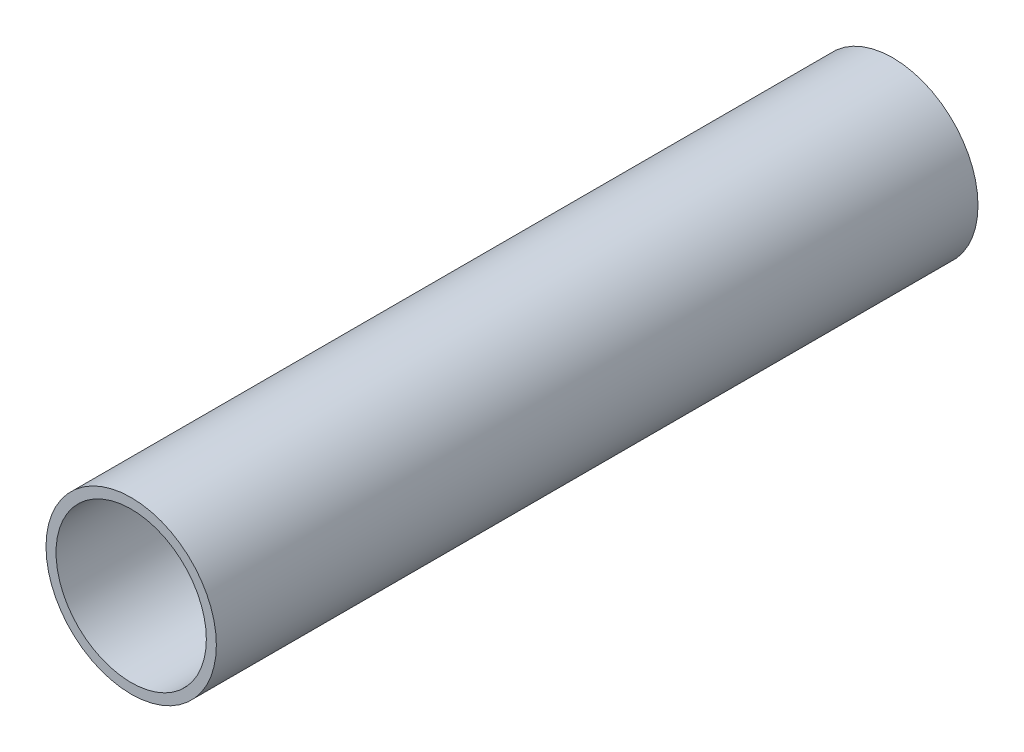
from build123d import *

# Parameters (mm, degrees)
ESQUISSE1_R             = 17
BOSS_EXTRU_1_DEPTH      = 2
ESQUISSE2_R             = 17
ESQUISSE2_R_2           = 15
BOSS_EXTRU_2_DEPTH      = 150
ESQUISSE3_R             = 12
ENL_V_MAT_EXTRU_1_DEPTH = 150


with BuildPart() as part:
    # Esquisse1 → Boss.-Extru.1 (new body)
    with BuildSketch(Plane.XY):
        Circle(ESQUISSE1_R)
    extrude(amount=BOSS_EXTRU_1_DEPTH)

    # Esquisse2 → Boss.-Extru.2 (add)
    with BuildSketch(Plane.XY.offset(2)):
        Circle(ESQUISSE2_R)
        Circle(ESQUISSE2_R_2, mode=Mode.SUBTRACT)
    extrude(amount=BOSS_EXTRU_2_DEPTH)

    # Esquisse3 → Enlèv. mat.-Extru.1 (cut)
    with BuildSketch(Plane(origin=(0, 0, 0), x_dir=(-1, 0, 0), z_dir=(0, 0, -1))):
        Circle(ESQUISSE3_R)
    extrude(amount=-ENL_V_MAT_EXTRU_1_DEPTH, mode=Mode.SUBTRACT)


solid = part.part
